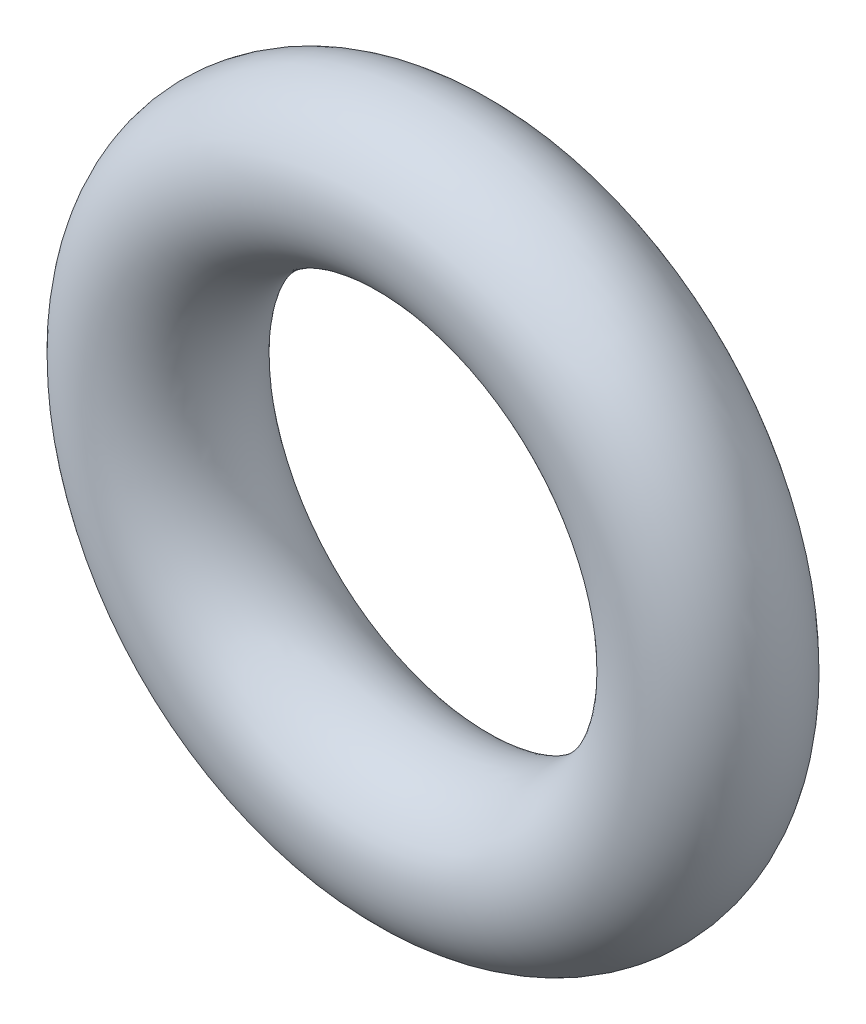
from build123d import *

# Parameters (mm, degrees)
SKETCH_1_R = 10


with BuildPart() as part:
    # 스케치1 → 회전1 (revolve)
    with BuildSketch(Plane(origin=(0, 0, 0), x_dir=(0, 0, -1), z_dir=(1, 0, 0))):
        with Locations((0, 35)):
            Circle(SKETCH_1_R)
    revolve(axis=Axis((0, 0, 210), (0, 0, -1)))


solid = part.part
